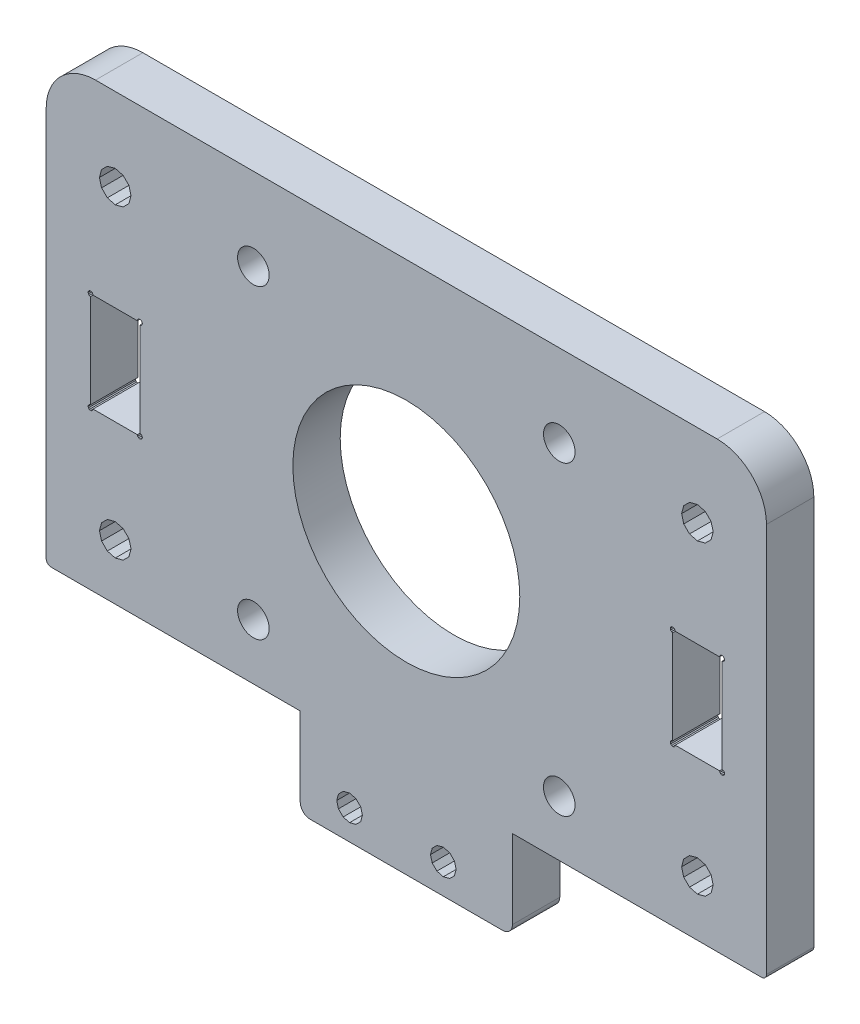
from build123d import *

# Parameters (mm, degrees)
ESQUISSE1_R        = 11.5
ESQUISSE1_R_2      = 1.6
BOSS_EXTRU_1_DEPTH = 4.8


with BuildPart() as part:
    # Esquisse1 → Boss.-Extru.1 (new body)
    with BuildSketch(Plane(origin=(0, 0, 0), x_dir=(-1, 0, 0), z_dir=(0, 0, -1))):
        with BuildLine():
            Line((0, 9.500081158), (0, 49.000418249))
            ThreePointArc((0, 49.000418249), (-1.464478579, 52.535982296), (-5.000042626, 54.000460875))
            Line((-5.000042626, 54.000460875), (-68.000581364, 54.000460875))
            ThreePointArc((-68.000581364, 54.000460875), (-71.53614516, 52.535982401), (-73.000623635, 49.000418605))
            Line((-73.000623635, 49.000418605), (-73.000623635, 9.500081158))
            ThreePointArc((-73.000623635, 9.500081158), (-72.854175775, 9.146524747), (-72.500619364, 9.000076887))
            Line((-72.500619364, 9.000076887), (-47.250403654, 9.000076887))
            Line((-47.250403654, 9.000076887), (-47.250403654, 1.000007743))
            ThreePointArc((-47.250403654, 1.000007743), (-46.95750587, 0.292889941), (-46.250388068, -7.843e-06))
            Line((-46.250388068, -7.843e-06), (-26.75023547, -7.843e-06))
            ThreePointArc((-26.75023547, -7.843e-06), (-26.043121781, 0.292888237), (-25.750225701, 1.000001925))
            Line((-25.750225701, 1.000001925), (-25.750225701, 9.000076887))
            Line((-25.750225701, 9.000076887), (-0.500004271, 9.000076887))
            ThreePointArc((-0.500004271, 9.000076887), (-0.14644786, 9.146524747), (0, 9.500081158))
        make_face()
        with Locations((-36.5004012, 30.150219609)):
            Circle(ESQUISSE1_R, mode=Mode.SUBTRACT)
        with Locations((-52.0004012, 14.650219609)):
            Circle(ESQUISSE1_R_2, mode=Mode.SUBTRACT)
        with Locations((-52.000444233, 45.650219609)):
            Circle(ESQUISSE1_R_2, mode=Mode.SUBTRACT)
        with Locations((-21.0004012, 14.650219609)):
            Circle(ESQUISSE1_R_2, mode=Mode.SUBTRACT)
        with Locations((-21.0004012, 45.650219609)):
            Circle(ESQUISSE1_R_2, mode=Mode.SUBTRACT)
        Polygon((-6.200052966, 47.036041823), (-5.614406963, 46.45039682), (-5.400046132, 45.650389986), (-5.614406963, 44.850383151), (-6.200052966, 44.264738148), (-7.000059801, 44.050376317), (-7.800066635, 44.264738148), (-8.385711638, 44.850383151), (-8.600073469, 45.650389986), (-8.385711638, 46.45039682), (-7.800066635, 47.036041823), (-7.000059801, 47.250403654), align=None, mode=Mode.SUBTRACT)
        Polygon((-4.750040579, 35.000299003), (-4.716546293, 35.125300071), (-4.625039511, 35.216810853), (-4.500038443, 35.250301139), (-4.375037375, 35.216810853), (-4.283530594, 35.125300071), (-4.250036308, 35.000299003), (-4.283530594, 34.875297935), (-4.375037375, 34.783787154), (-4.500038443, 34.750296868), (-4.500038443, 25.250215709), (-4.375037375, 25.216725423), (-4.283530594, 25.125214642), (-4.250036308, 25.000213574), (-4.283530594, 24.875212506), (-4.375037375, 24.783701724), (-4.500038443, 24.750211438), (-4.625039511, 24.783701724), (-4.716546293, 24.875212506), (-4.750040579, 25.000213574), (-9.250079022, 25.000213574), (-9.283572308, 24.875212506), (-9.37508009, 24.783701724), (-9.500081158, 24.750211438), (-9.625082226, 24.783701724), (-9.716589008, 24.875212506), (-9.750083294, 25.000213574), (-9.716589008, 25.125214642), (-9.625082226, 25.216725423), (-9.500081158, 25.250215709), (-9.500081158, 34.750296868), (-9.625082226, 34.783787154), (-9.716589008, 34.875297935), (-9.750083294, 35.000299003), (-9.716589008, 35.125300071), (-9.625082226, 35.216810853), (-9.500081158, 35.250301139), (-9.37508009, 35.216810853), (-9.283572308, 35.125300071), (-9.250079022, 35.000299003), align=None, mode=Mode.SUBTRACT)
        Polygon((-5.614406963, 15.450131989), (-5.400046132, 14.650125154), (-5.614406963, 13.85011832), (-6.200052966, 13.264473317), (-7.000059801, 13.050111485), (-7.800066635, 13.264473317), (-8.385711638, 13.85011832), (-8.600073469, 14.650125154), (-8.385711638, 15.450131989), (-7.800066635, 16.035776992), (-7.000059801, 16.250138823), (-6.200052966, 16.035776992), align=None, mode=Mode.SUBTRACT)
        Polygon((-30.100257143, 1.874182011), (-30.750262696, 1.700013523), (-31.400268249, 1.874182011), (-31.876102314, 2.350020076), (-32.050273802, 3.000025629), (-31.876102314, 3.650030182), (-31.400268249, 4.125868247), (-30.750262696, 4.300036735), (-30.100257143, 4.125868247), (-29.624423078, 3.650030182), (-29.45025159, 3.000025629), (-29.624423078, 2.350020076), align=None, mode=Mode.SUBTRACT)
        Polygon((-39.600338301, 1.874182011), (-40.250343854, 1.700013523), (-40.900349407, 1.874182011), (-41.376193472, 2.350020076), (-41.55035496, 3.000025629), (-41.376193472, 3.650030182), (-40.900349407, 4.125868247), (-40.250343854, 4.300036735), (-39.600338301, 4.125868247), (-39.124504236, 3.650030182), (-38.950332748, 3.000025629), (-39.124504236, 2.350020076), align=None, mode=Mode.SUBTRACT)
        Polygon((-64.400550166, 14.650125154), (-64.614911997, 13.85011832), (-65.200557, 13.264473317), (-66.000563835, 13.050111485), (-66.800570669, 13.264473317), (-67.386215672, 13.85011832), (-67.600577503, 14.650125154), (-67.386215672, 15.450131989), (-66.800570669, 16.035776992), (-66.000563835, 16.250138823), (-65.200557, 16.035776992), (-64.614911997, 15.450131989), align=None, mode=Mode.SUBTRACT)
        Polygon((-63.625543545, 24.783701724), (-63.717054327, 24.875212506), (-63.750544613, 25.000213574), (-68.250583056, 25.000213574), (-68.284073342, 24.875212506), (-68.375584124, 24.783701724), (-68.500585192, 24.750211438), (-68.62558626, 24.783701724), (-68.717097042, 24.875212506), (-68.750587328, 25.000213574), (-68.717097042, 25.125214642), (-68.62558626, 25.216725423), (-68.500585192, 25.250215709), (-68.500585192, 34.750296868), (-68.62558626, 34.783787154), (-68.717097042, 34.875297935), (-68.750587328, 35.000299003), (-68.717097042, 35.125300071), (-68.62558626, 35.216810853), (-68.500585192, 35.250301139), (-68.375584124, 35.216810853), (-68.284073342, 35.125300071), (-68.250583056, 35.000299003), (-63.750544613, 35.000299003), (-63.717054327, 35.125300071), (-63.625543545, 35.216810853), (-63.500542477, 35.250301139), (-63.375541409, 35.216810853), (-63.284040628, 35.125300071), (-63.250540342, 35.000299003), (-63.284040628, 34.875297935), (-63.375541409, 34.783787154), (-63.500542477, 34.750296868), (-63.500542477, 25.250215709), (-63.375541409, 25.216725423), (-63.284040628, 25.125214642), (-63.250540342, 25.000213574), (-63.284040628, 24.875212506), (-63.375541409, 24.783701724), (-63.500542477, 24.750211438), align=None, mode=Mode.SUBTRACT)
        Polygon((-66.800570669, 47.036041823), (-66.000563835, 47.250403654), (-65.200557, 47.036041823), (-64.614911997, 46.45039682), (-64.400550166, 45.650389986), (-64.614911997, 44.850383151), (-65.200557, 44.264738148), (-66.000563835, 44.050376317), (-66.800570669, 44.264738148), (-67.386215672, 44.850383151), (-67.600577503, 45.650389986), (-67.386215672, 46.45039682), align=None, mode=Mode.SUBTRACT)
    extrude(amount=-BOSS_EXTRU_1_DEPTH)


solid = part.part
